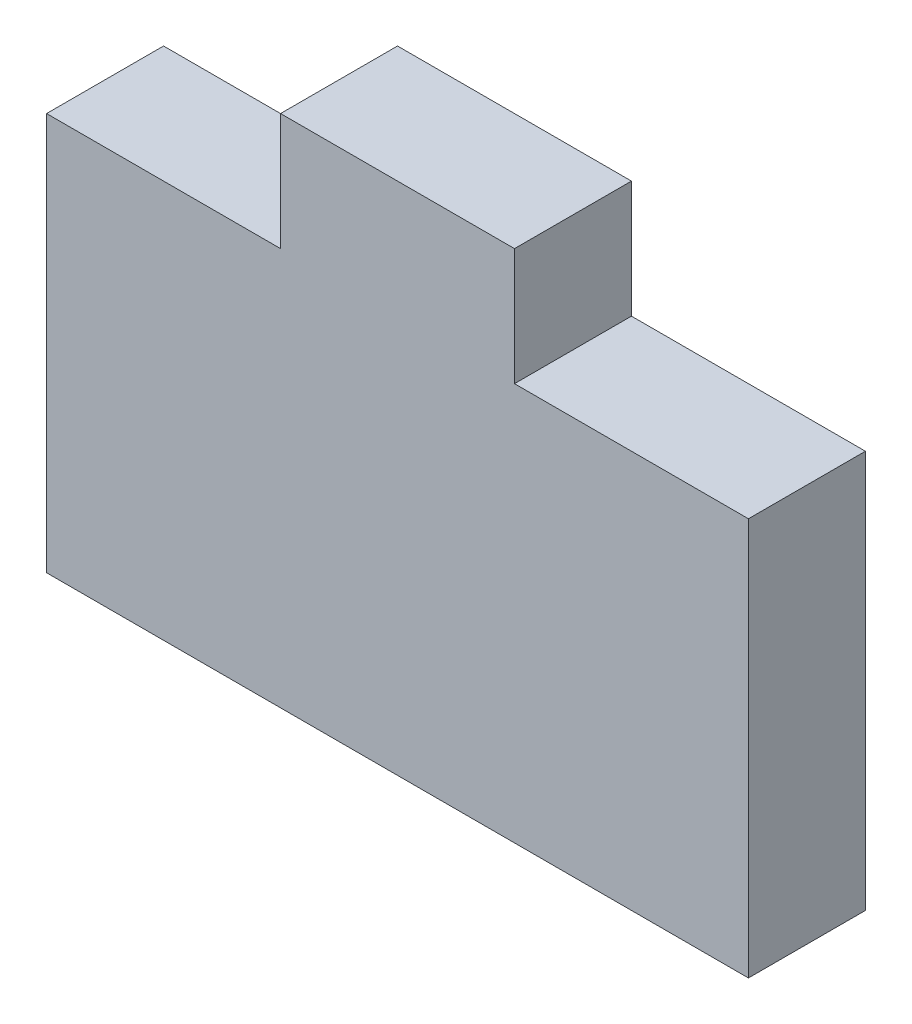
from build123d import *

# Parameters (mm, degrees)
BOSS_EXTRUDE1_DEPTH = 9.525


with BuildPart() as part:
    # Sketch2 → Boss-Extrude1 (new body)
    with BuildSketch(Plane.XY):
        Polygon((0, 32.385), (0, 0), (57.15, 0), (57.15, 32.385), (38.1, 32.385), (38.1, 41.91), (19.05, 41.91), (19.05, 32.385), align=None)
    extrude(amount=BOSS_EXTRUDE1_DEPTH)


solid = part.part
